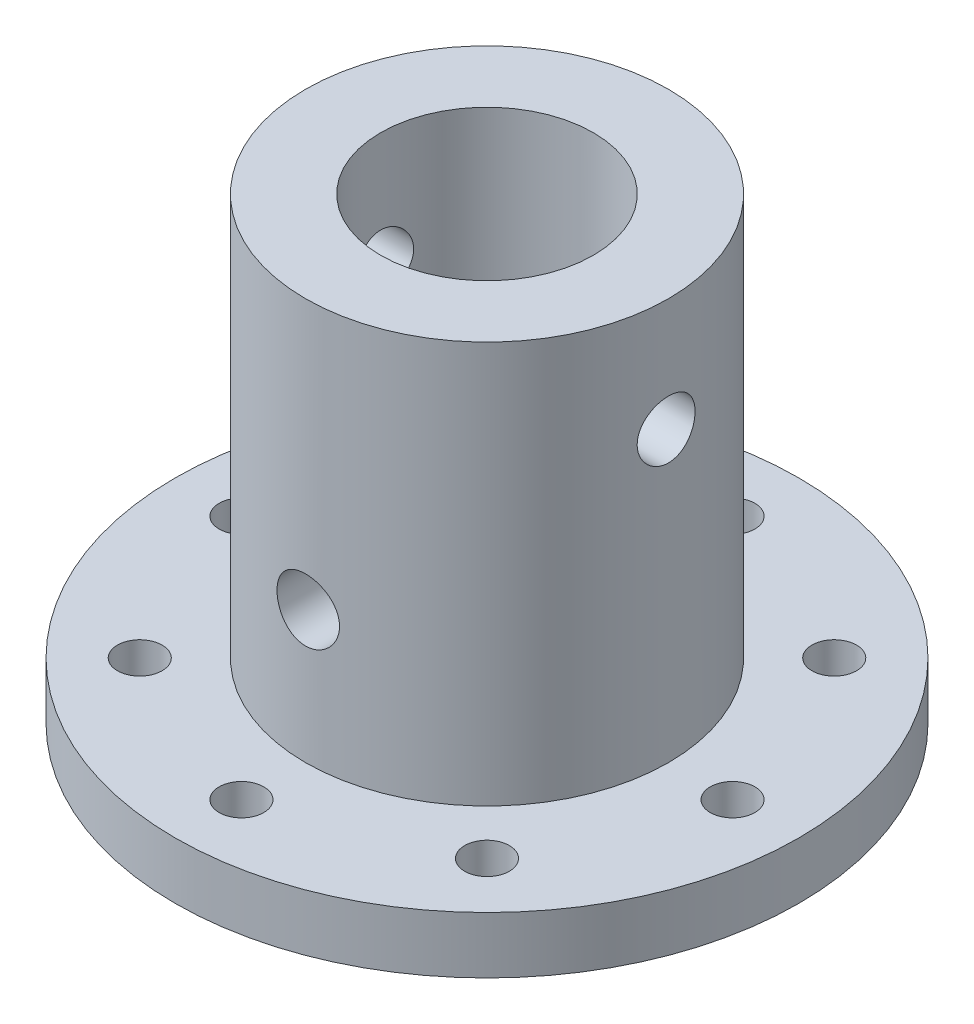
from build123d import *

# Parameters (mm, degrees)
SKETCH1_R               = 13.97
BOSS_EXTRUDE1_DEPTH     = 2.54
SKETCH2_R               = 8.128
BOSS_EXTRUDE2_DEPTH     = 18
SKETCH6_R               = 1
CUT_EXTRUDE2_DEPTH      = 29.499357888
SKETCH7_R               = 4.7625
CUT_EXTRUDE3_DEPTH      = 25.4
CUT_EXTRUDE6_DEPTH      = 24.13
CUT_EXTRUDE6_DEPTH_BACK = 24.13
SKETCH11_R              = 1.4
CUT_EXTRUDE7_DEPTH      = 29.49935796
CUT_EXTRUDE7_DEPTH_BACK = 29.49935796
SKETCH12_R              = 1.296623243


with BuildPart() as part:
    # Sketch1 → Boss-Extrude1 (new body)
    with BuildSketch(Plane(origin=(0, 0, 0), x_dir=(1, 0, 0), z_dir=(0, 1, 0))):
        Circle(SKETCH1_R)
    extrude(amount=BOSS_EXTRUDE1_DEPTH)

    # Sketch2 → Boss-Extrude2 (add)
    with BuildSketch(Plane(origin=(0, 2.54, 0), x_dir=(1, 0, 0), z_dir=(0, 1, 0))):
        Circle(SKETCH2_R)
    extrude(amount=BOSS_EXTRUDE2_DEPTH)

    # Sketch6 → Cut-Extrude2 (cut, through all)
    with BuildSketch(Plane(origin=(0, 0, 0), x_dir=(-1, 0, 0), z_dir=(0, -1, 0))):
        with Locations((-11, 0)):
            Circle(SKETCH6_R)
        with Locations((-7.778174593, 7.778174593)):
            Circle(SKETCH6_R)
        with Locations((0, 11)):
            Circle(SKETCH6_R)
        with Locations((7.778174593, 7.778174593)):
            Circle(SKETCH6_R)
        with Locations((11, 0)):
            Circle(SKETCH6_R)
        with Locations((7.778174593, -7.778174593)):
            Circle(SKETCH6_R)
        with Locations((0, -11)):
            Circle(SKETCH6_R)
        with Locations((-7.778174593, -7.778174593)):
            Circle(SKETCH6_R)
    extrude(amount=-CUT_EXTRUDE2_DEPTH, mode=Mode.SUBTRACT)

    # Sketch7 → Cut-Extrude3 (cut)
    with BuildSketch(Plane(origin=(0, 20.54, 0), x_dir=(1, 0, 0), z_dir=(0, 1, 0))):
        Circle(SKETCH7_R)
    extrude(amount=-CUT_EXTRUDE3_DEPTH, mode=Mode.SUBTRACT)

    # Sketch11 → Cut-Extrude6 (cut, two sides: drawn at the far end of the back side and taken through both)
    with BuildSketch(Plane.XY.offset(-CUT_EXTRUDE6_DEPTH_BACK)):
        with Locations((0, 8.466000018)):
            Circle(SKETCH11_R)
    extrude(amount=CUT_EXTRUDE6_DEPTH + CUT_EXTRUDE6_DEPTH_BACK, mode=Mode.SUBTRACT)

    # Sketch12 → Cut-Extrude7 (cut, two sides: drawn at the far end of the back side and taken through both)
    with BuildSketch(Plane(origin=(0, 0, 0), x_dir=(0, 0, -1), z_dir=(1, 0, 0)).offset(-CUT_EXTRUDE7_DEPTH_BACK)):
        with Locations((0, 15.466)):
            Circle(SKETCH12_R)
    extrude(amount=CUT_EXTRUDE7_DEPTH + CUT_EXTRUDE7_DEPTH_BACK, mode=Mode.SUBTRACT)


solid = part.part
